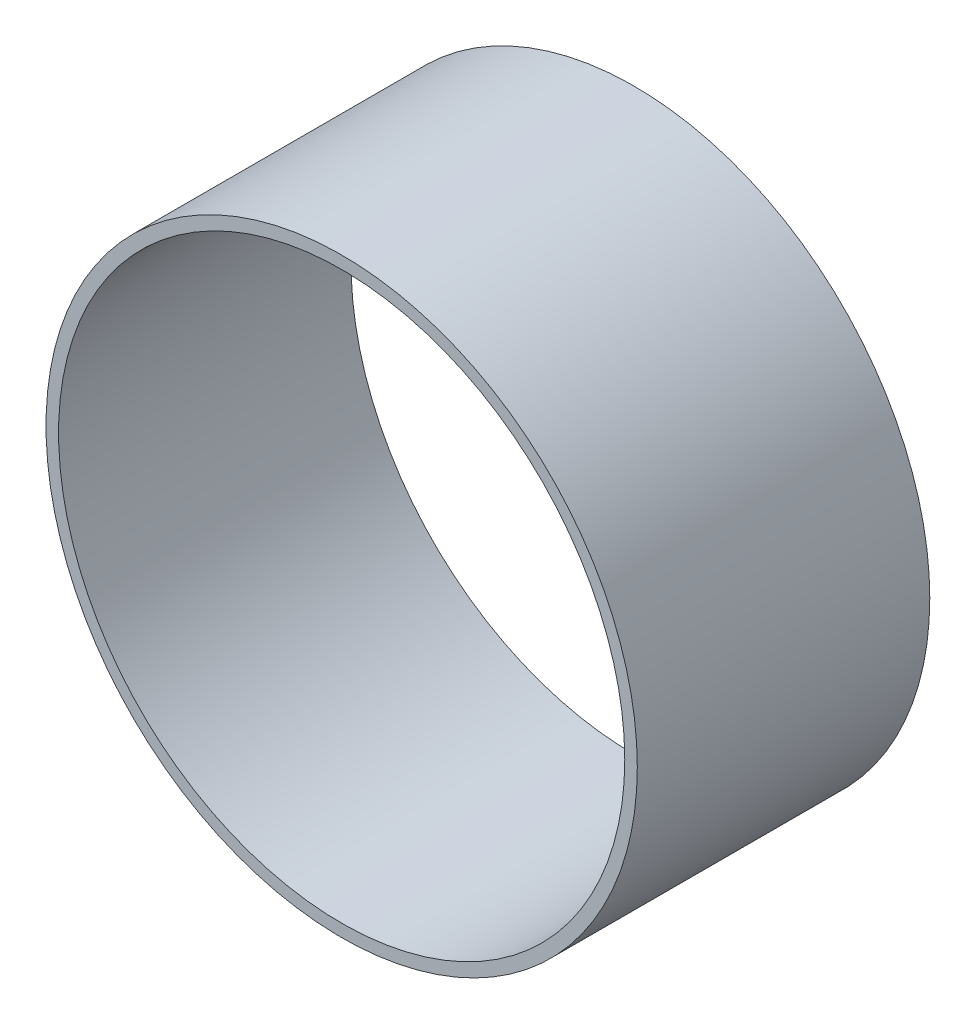
from build123d import *

# Parameters (mm, degrees)
ROTOR_SHELL_START = -35
SKETCH_1_R        = 70.753846154
SKETCH_1_R_2      = 67.753846154
ROTOR_SHELL_DEPTH = 70


with BuildPart() as part:
    # Эскиз1 → Rotor_shell (new body)
    with BuildSketch(Plane.XY.offset(ROTOR_SHELL_START)):
        Circle(SKETCH_1_R)
        Circle(SKETCH_1_R_2, mode=Mode.SUBTRACT)
    extrude(amount=ROTOR_SHELL_DEPTH)


solid = part.part
